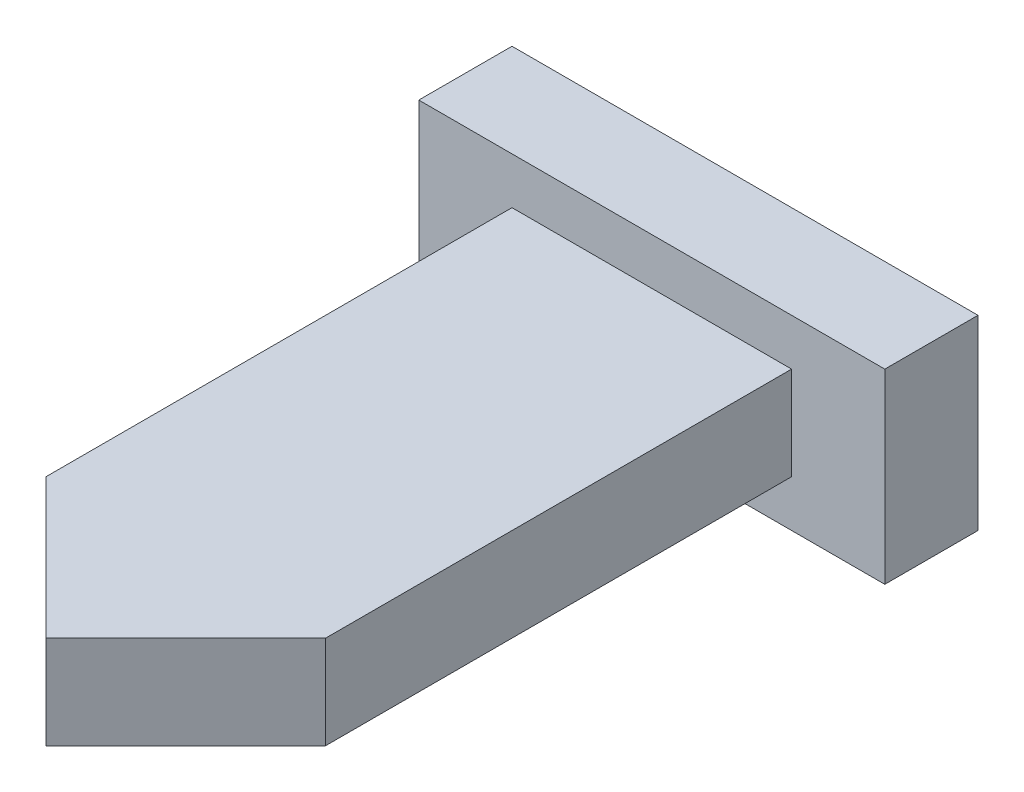
from build123d import *

# Parameters (mm, degrees)
BOSS_EXTRUDE1_DEPTH = 15
BOSS_EXTRUDE2_DEPTH = 7.5


with BuildPart() as part:
    # Sketch1 → Boss-Extrude1 (new, symmetric)
    with BuildSketch(Plane(origin=(0, 0, 0), x_dir=(-1, 0, 0), z_dir=(0, 1, 0))):
        Polygon((-37.5, 15), (-37.5, 0), (37.5, 0), (37.5, 15), (22.5, 15), (-22.5, 15), align=None)
    extrude(amount=BOSS_EXTRUDE1_DEPTH, both=True)

    # Sketch1<3> → Boss-Extrude2 (add, symmetric)
    with BuildSketch(Plane(origin=(0, 0, 0), x_dir=(-1, 0, 0), z_dir=(0, 1, 0))):
        Polygon((-22.5, 90), (-22.5, 15), (22.5, 15), (22.5, 90), (0, 112.5), align=None)
    extrude(amount=BOSS_EXTRUDE2_DEPTH, both=True)


solid = part.part
